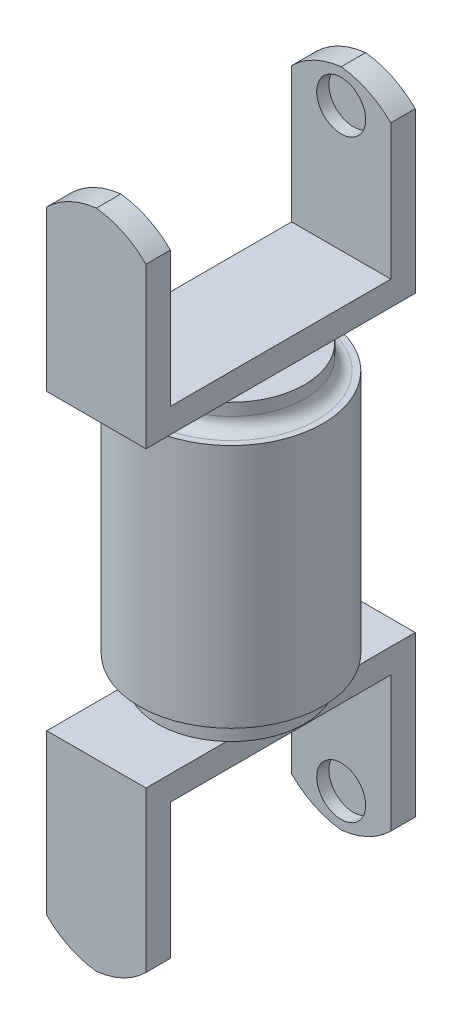
from build123d import *

# Parameters (mm, degrees)
SKETCH1_R           = 7.5
BOSS_EXTRUDE1_DEPTH = 10
SKETCH5_R           = 6
BOSS_EXTRUDE2_DEPTH = 2
FILLET2_R           = 1
BOSS_EXTRUDE3_DEPTH = 6
CUT_EXTRUDE4_DEPTH  = 29
CUT_EXTRUDE5_START  = -1
SKETCH10_R          = 2
CUT_EXTRUDE5_DEPTH  = 20
CUT_EXTRUDE6_START  = -24
CUT_EXTRUDE6_DEPTH  = 24


with BuildPart() as part:
    # Sketch1 → Boss-Extrude1 (new body)
    with BuildSketch(Plane(origin=(0, 0, 0), x_dir=(1, 0, 0), z_dir=(0, 1, 0))):
        Circle(SKETCH1_R)
    boss_extrude1 = extrude(amount=BOSS_EXTRUDE1_DEPTH)

    # Sketch5 → Boss-Extrude2 (add)
    with BuildSketch(Plane(origin=(0, 10, 0), x_dir=(1, 0, 0), z_dir=(0, 1, 0))):
        Circle(SKETCH5_R)
    boss_extrude2 = extrude(amount=BOSS_EXTRUDE2_DEPTH)

    # Fillet2
    fillet2_edges = [part.edges().sort_by_distance(p)[0] for p in [
        (-6, 10, 0),
    ]]
    fillet(fillet2_edges, radius=FILLET2_R)

    # Sketch6 → Boss-Extrude3 (add, symmetric)
    with BuildSketch(Plane(origin=(0, 0, 0), x_dir=(0, 0, -1), z_dir=(1, 0, 0))):
        Polygon((6, 12), (-6, 12), (-11, 12), (-11, 27), (-9, 27), (-9, 14), (9, 14), (9, 27), (11, 27), (11, 12), align=None)
    boss_extrude3 = extrude(amount=BOSS_EXTRUDE3_DEPTH, both=True)

    # Sketch9 → Cut-Extrude4 (cut)
    with BuildSketch(Plane.XY.offset(11)):
        with BuildLine():
            Line((-6, 27), (-6, 21))
            ThreePointArc((-6, 21), (-4.052343178, 25.052343178), (0, 27))
            Line((0, 27), (-6, 27))
        make_face()
        with BuildLine():
            ThreePointArc((0, 27), (4.052343178, 25.052343178), (6, 21))
            Line((6, 21), (6, 27))
            Line((6, 27), (0, 27))
        make_face()
    cut_extrude4 = extrude(amount=-CUT_EXTRUDE4_DEPTH, mode=Mode.SUBTRACT)

    # Sketch10 → Cut-Extrude5 (cut)
    with BuildSketch(Plane(origin=(0, 0, 9), x_dir=(-1, 0, 0), z_dir=(0, 0, -1)).offset(CUT_EXTRUDE5_START)):
        with Locations((0, 24.25)):
            Circle(SKETCH10_R)
    cut_extrude5 = extrude(amount=CUT_EXTRUDE5_DEPTH, mode=Mode.SUBTRACT)

    # Mirror2: Boss-Extrude1 across plane
    add(boss_extrude1.mirror(Plane.ZX))

    # Mirror9: Boss-Extrude2, Boss-Extrude3 across plane
    add(boss_extrude2.mirror(Plane.ZX))
    add(boss_extrude3.mirror(Plane.ZX))

    # Mirror11: Cut-Extrude4, Cut-Extrude5 across plane
    add(cut_extrude4.mirror(Plane.ZX), mode=Mode.SUBTRACT)
    add(cut_extrude5.mirror(Plane.ZX), mode=Mode.SUBTRACT)

    # Sketch11 → Cut-Extrude6 (cut)
    with BuildSketch(Plane(origin=(0, 0, -11), x_dir=(-1, 0, 0), z_dir=(0, 0, -1)).offset(CUT_EXTRUDE6_START)):
        with BuildLine():
            Line((-4.052343178, 12), (-4.052343178, 25.052343178))
            ThreePointArc((-4.052343178, 25.052343178), (-5.371235948, 23.192018094), (-6, 21))
            Line((-6, 21), (-6, 12))
            Line((-6, 12), (-4.052343178, 12))
        make_face()
        with BuildLine():
            Line((4.052343178, 25.052343178), (4.052343178, 12))
            Line((4.052343178, 12), (6, 12))
            Line((6, 12), (6, 21))
            ThreePointArc((6, 21), (5.371235948, 23.192018094), (4.052343178, 25.052343178))
        make_face()
    cut_extrude6 = extrude(amount=CUT_EXTRUDE6_DEPTH, mode=Mode.SUBTRACT)

    # Mirror12: Cut-Extrude6 across plane
    add(cut_extrude6.mirror(Plane.ZX), mode=Mode.SUBTRACT)


solid = part.part
